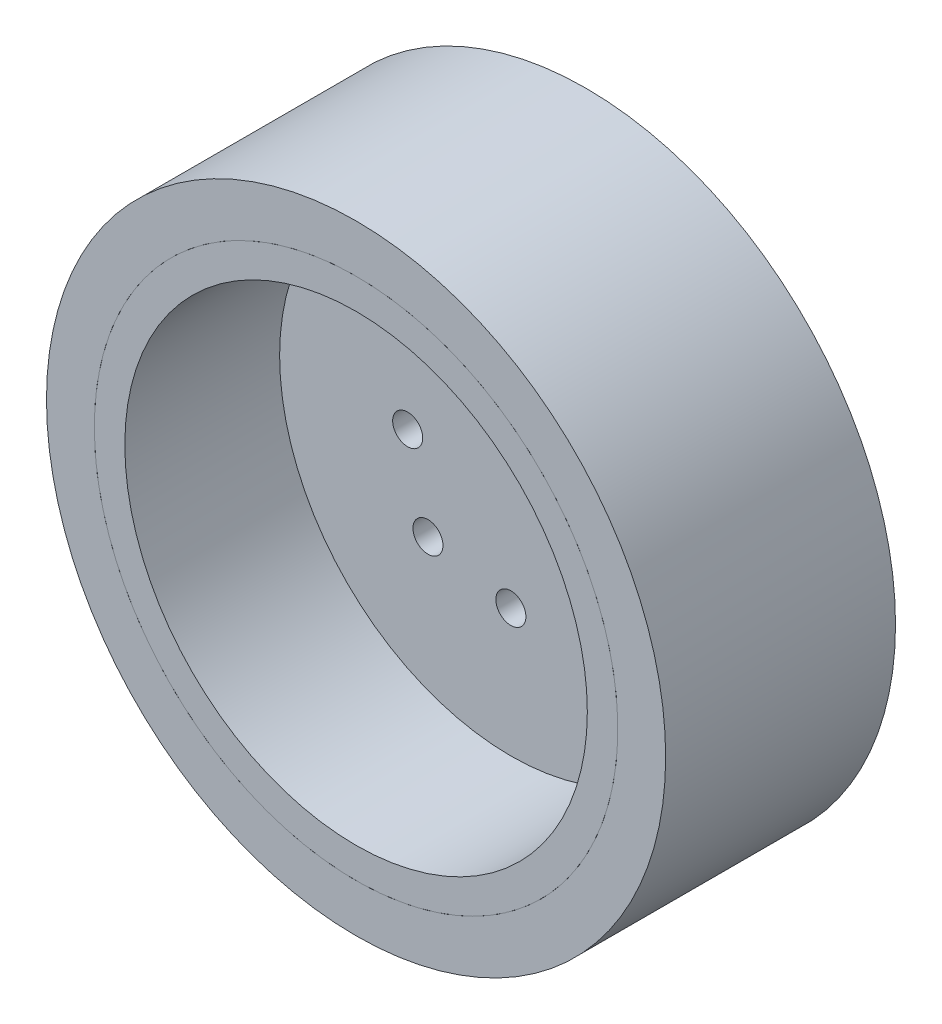
from build123d import *

# Parameters (mm, degrees)
SKETCH_1_R          = 26.4
EXTRUDE_1_DEPTH     = 24.5
SKETCH_2_R          = 24.65
CUT_EXTRUDE_1_DEPTH = 16.5
EXTRUDE_START       = -1.5
SKETCH_5_R          = 27.9
SKETCH_5_R_2        = 26.4
EXTRUDE_3_DEPTH     = 1.5
SKETCH_4_R          = 1.6
CUT_EXTRUDE_2_DEPTH = 47.444267676


with BuildPart() as part:
    # 草图1 → 凸台-拉伸1 (new body)
    with BuildSketch(Plane.XY):
        Circle(SKETCH_1_R)
    extrude(amount=EXTRUDE_1_DEPTH)

    # 草图2 → 切除-拉伸1 (cut)
    with BuildSketch(Plane.XY.offset(24.5)):
        Circle(SKETCH_2_R)
    extrude(amount=-CUT_EXTRUDE_1_DEPTH, mode=Mode.SUBTRACT)

    # 草图5 → 凸台-拉伸3 (add)
    with BuildSketch(Plane.XY.offset(24.5).offset(EXTRUDE_START)):
        Circle(SKETCH_5_R)
        Circle(SKETCH_5_R_2, mode=Mode.SUBTRACT)
    extrude_3 = extrude(amount=EXTRUDE_3_DEPTH)

    # 镜向1: 凸台-拉伸3 across plane
    add(extrude_3.mirror(Plane(origin=(0, 0, 12.25), x_dir=(1, 0, 0), z_dir=(0, 0, -1))))

    # 草图4 → 切除-拉伸2 (cut, through all)
    with BuildSketch(Plane(origin=(0, 0, 0), x_dir=(-1, 0, 0), z_dir=(0, 0, -1))):
        with Locations((0, 11)):
            Circle(SKETCH_4_R)
        with Locations((11, 0)):
            Circle(SKETCH_4_R)
        with Locations((0, -11)):
            Circle(SKETCH_4_R)
        with Locations((-11, 0)):
            Circle(SKETCH_4_R)
        with Locations((8.838834765, 8.838834765)):
            Circle(SKETCH_4_R)
        with Locations((-8.838834765, 8.838834765)):
            Circle(SKETCH_4_R)
        with Locations((-8.838834765, -8.838834765)):
            Circle(SKETCH_4_R)
        with Locations((8.838834765, -8.838834765)):
            Circle(SKETCH_4_R)
    extrude(amount=-CUT_EXTRUDE_2_DEPTH, mode=Mode.SUBTRACT)


with BuildPart() as body_2:
    # 草图6 → 旋转1 (revolve)
    with BuildSketch(Plane(origin=(0, 0, 0), x_dir=(1, 0, 0), z_dir=(0, 1, 0))):
        Polygon((-33, 0), (-33, -24.5), (-27.9, -24.5), (-27.9, -23), (-26.4, -23), (-26.4, -1.5), (-27.9, -1.5), (-27.9, 0), align=None)
    revolve(axis=Axis((0, 0, -0.338387196), (0, 0, 1)))


solid = Compound([part.part, body_2.part])
